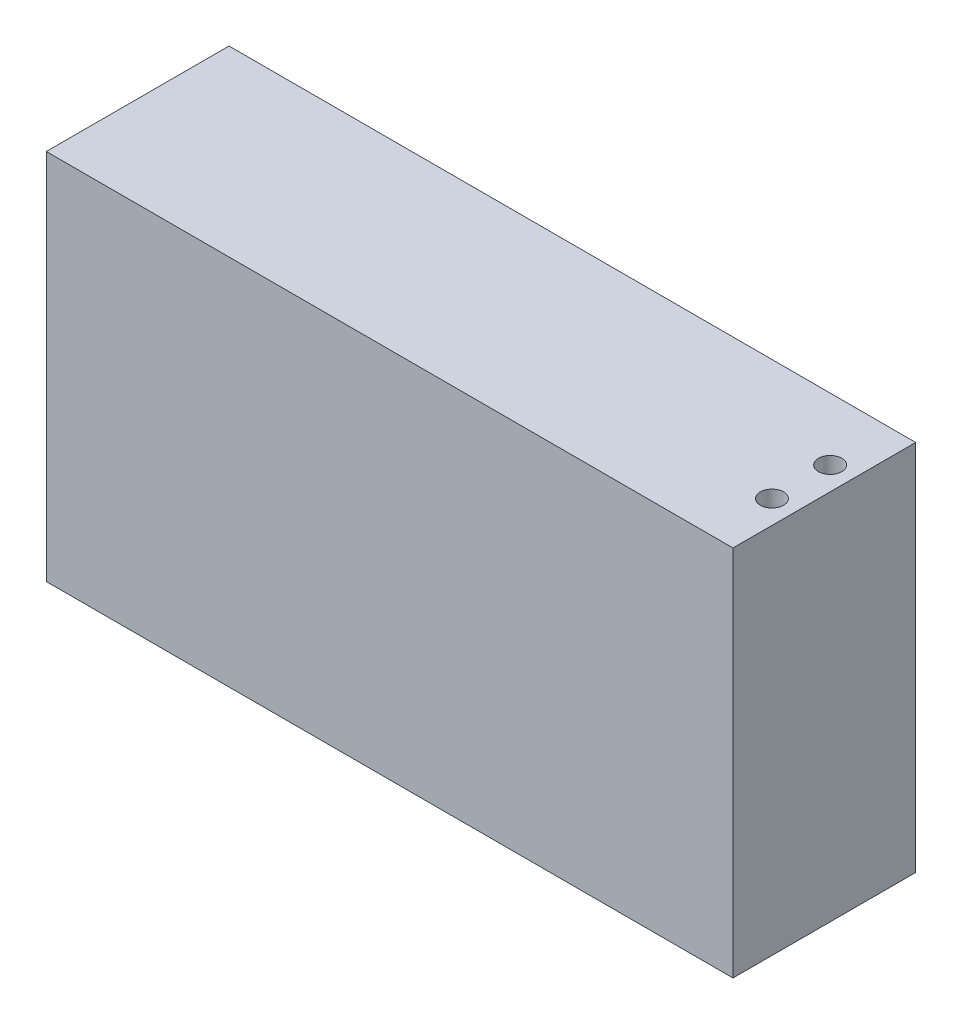
from build123d import *

# Parameters (mm, degrees)
SKETCH1_W           = 590
SKETCH1_H           = 157
BOSS_EXTRUDE1_DEPTH = 320
SKETCH2_R           = 10
CUT_EXTRUDE1_DEPTH  = 80


with BuildPart() as part:
    # Sketch1 → Boss-Extrude1 (new body)
    with BuildSketch(Plane(origin=(0, 0, 0), x_dir=(1, 0, 0), z_dir=(0, 1, 0))):
        with Locations((295, 78.5)):
            Rectangle(SKETCH1_W, SKETCH1_H)
    extrude(amount=BOSS_EXTRUDE1_DEPTH)

    # Sketch2 → Cut-Extrude1 (cut)
    with BuildSketch(Plane(origin=(0, 320, 0), x_dir=(1, 0, 0), z_dir=(0, 1, 0))):
        with Locations(Location((570, 103.5, 0), (0, 0, 270))):
            Circle(SKETCH2_R)
        with Locations(Location((570, 53.5, 0), (0, 0, 270))):
            Circle(SKETCH2_R)
    extrude(amount=-CUT_EXTRUDE1_DEPTH, mode=Mode.SUBTRACT)


solid = part.part
